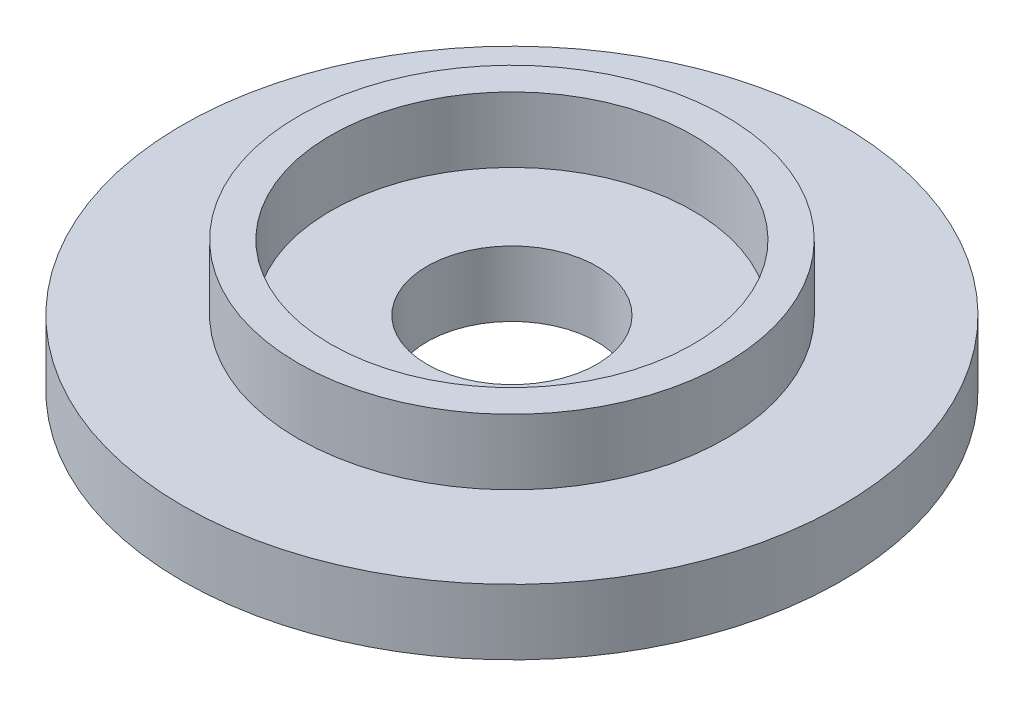
from build123d import *

# Parameters (mm, degrees)
SKETCH2_R           = 64
BOSS_EXTRUDE1_DEPTH = 12.7
SKETCH3_R           = 41.515692032
SKETCH3_R_2         = 35.165692032
BOSS_EXTRUDE2_DEPTH = 12.7
SKETCH4_R           = 16.498149644
CUT_EXTRUDE1_DEPTH  = 635


with BuildPart() as part:
    # Sketch2 → Boss-Extrude1 (new body)
    with BuildSketch(Plane(origin=(0, 0, 0), x_dir=(1, 0, 0), z_dir=(0, 1, 0))):
        with Locations(Location((0, 0, 0), (0, 0, 270))):
            Circle(SKETCH2_R)
    extrude(amount=BOSS_EXTRUDE1_DEPTH)

    # Sketch3 → Boss-Extrude2 (add)
    with BuildSketch(Plane(origin=(0, 12.7, 0), x_dir=(1, 0, 0), z_dir=(0, 1, 0))):
        with Locations(Location((0, 0, 0), (0, 0, 270))):
            Circle(SKETCH3_R)
        with Locations(Location((0, 0, 0), (0, 0, 270))):
            Circle(SKETCH3_R_2, mode=Mode.SUBTRACT)
    extrude(amount=BOSS_EXTRUDE2_DEPTH)

    # Sketch4 → Cut-Extrude1 (cut)
    with BuildSketch(Plane(origin=(0, 25.4, 0), x_dir=(1, 0, 0), z_dir=(0, 1, 0))):
        with Locations(Location((0, 0, 0), (0, 0, 270))):
            Circle(SKETCH4_R)
    extrude(amount=-CUT_EXTRUDE1_DEPTH, mode=Mode.SUBTRACT)


solid = part.part
